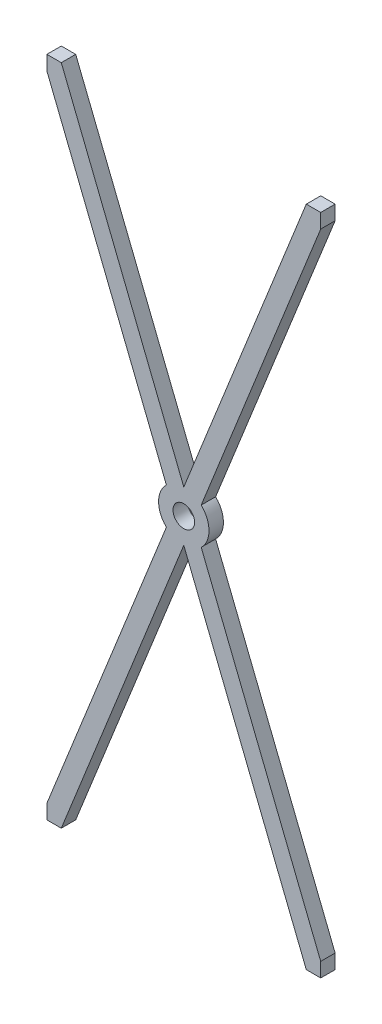
from build123d import *

# Parameters (mm, degrees)
AUFSATZ_LINEAR_AUSTRAGEN1_DEPTH = 50
SKIZZE2_R                       = 87.5
SKIZZE2_R_2                     = 35
AUFSATZ_LINEAR_AUSTRAGEN2_DEPTH = 50
SCHNITT_LINEAR_AUSTRAGEN1_DEPTH = 50


with BuildPart() as part:
    # Skizze1 → Aufsatz-Linear austragen1 (new body)
    with BuildSketch(Plane.XY):
        Polygon((0, 2300), (50, 2300), (475, 1237.5), (900, 2300), (950, 2300), (950, 2250), (510, 1150), (950, 50), (950, 0), (900, 0), (475, 1062.5), (50, 0), (0, 0), (0, 50), (440, 1150), (0, 2250), align=None)
    extrude(amount=AUFSATZ_LINEAR_AUSTRAGEN1_DEPTH)

    # Skizze2 → Aufsatz-Linear austragen2 (add)
    with BuildSketch(Plane.XY.offset(50)):
        with Locations((475, 1150)):
            Circle(SKIZZE2_R)
        with Locations((475, 1150)):
            Circle(SKIZZE2_R_2, mode=Mode.SUBTRACT)
    extrude(amount=-AUFSATZ_LINEAR_AUSTRAGEN2_DEPTH)

    # Skizze4 → Schnitt-Linear austragen1 (cut)
    with BuildSketch(Plane.XY.offset(50)):
        with BuildLine():
            ThreePointArc((512.5, 1150), (501.516504294, 1176.516504294), (475, 1187.5))
            Line((475, 1187.5), (475, 1112.5))
            ThreePointArc((475, 1112.5), (501.516504294, 1123.483495706), (512.5, 1150))
        make_face()
        with BuildLine():
            Line((475, 1112.5), (475, 1187.5))
            ThreePointArc((475, 1187.5), (437.5, 1150), (475, 1112.5))
        make_face()
    extrude(amount=-SCHNITT_LINEAR_AUSTRAGEN1_DEPTH, mode=Mode.SUBTRACT)


solid = part.part
